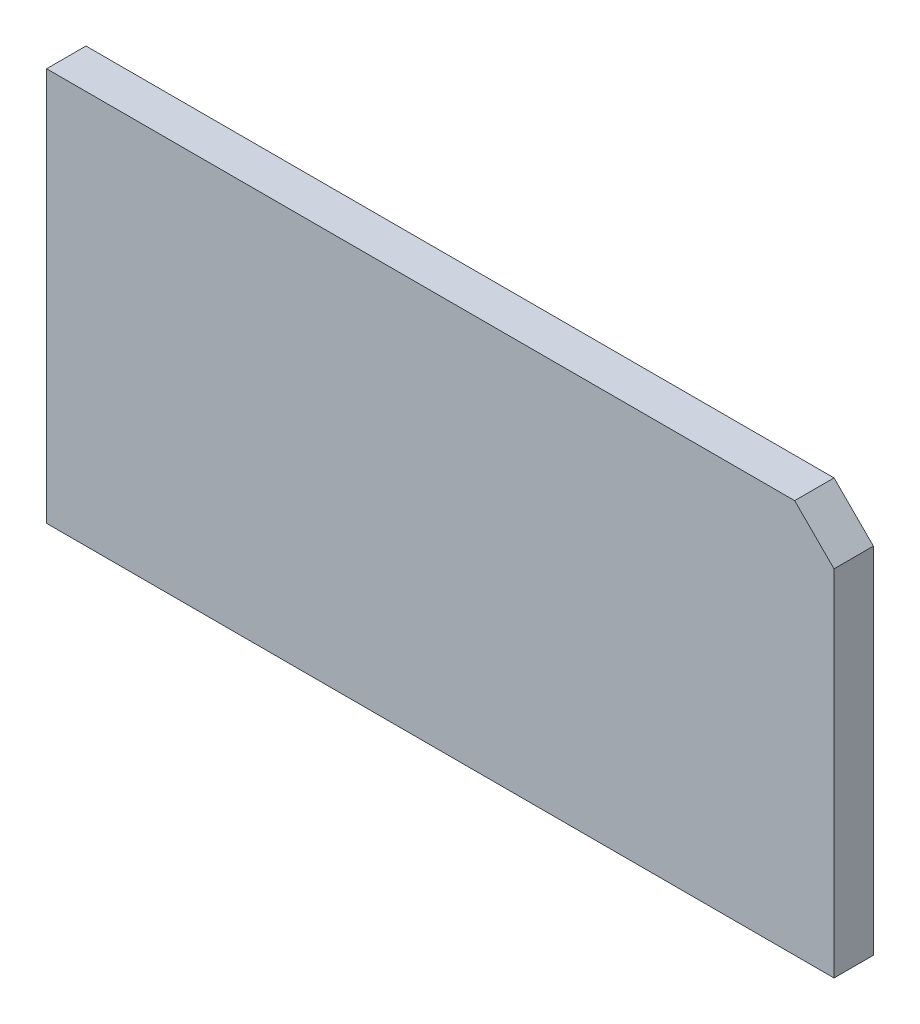
from build123d import *

# Parameters (mm, degrees)
SKETCH1_W           = 2000
SKETCH1_H           = 1000
BOSS_EXTRUDE1_DEPTH = 100
CUT_EXTRUDE1_DEPTH  = 200


with BuildPart() as part:
    # Sketch1 → Boss-Extrude1 (new body)
    with BuildSketch(Plane.XY):
        Rectangle(SKETCH1_W, SKETCH1_H)
    extrude(amount=-BOSS_EXTRUDE1_DEPTH)

    # Sketch2 → Cut-Extrude1 (cut)
    with BuildSketch(Plane.XY):
        Polygon((900, 500), (1000, 400), (1000, 500), align=None)
    extrude(amount=-CUT_EXTRUDE1_DEPTH, mode=Mode.SUBTRACT)


solid = part.part
